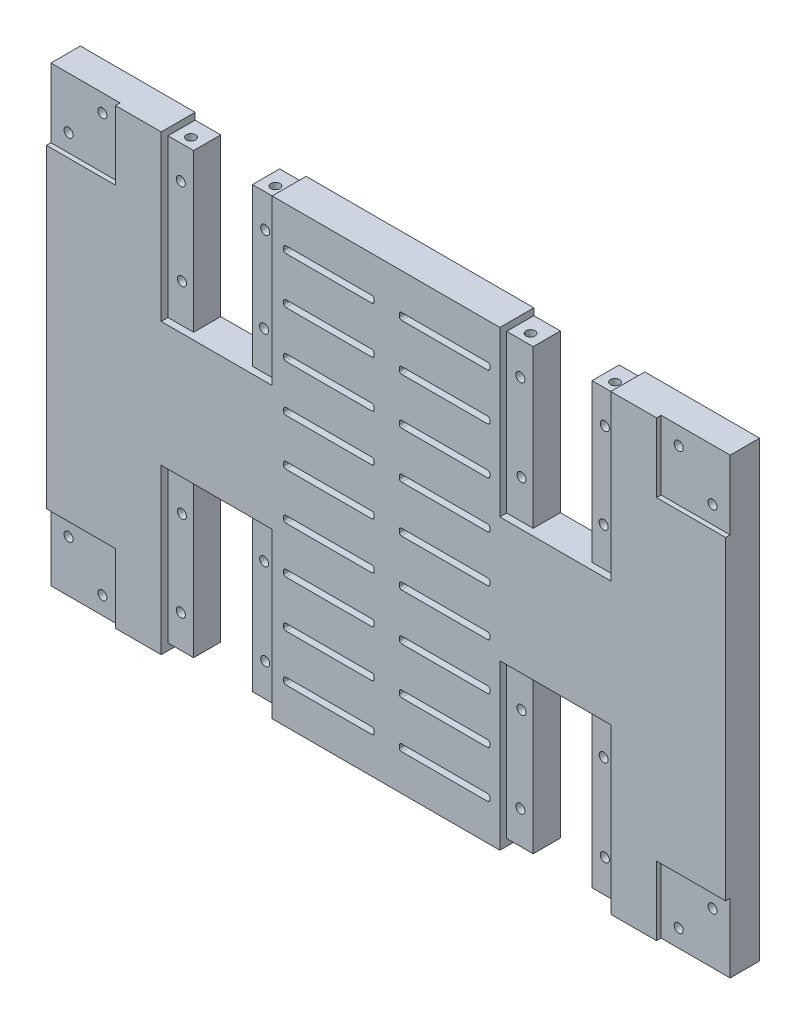
from build123d import *

# Parameters (mm, degrees)
CROQUIS1_W              = 300
CROQUIS1_H              = 200
SALIENTE_EXTRUIR1_DEPTH = 15
CROQUIS2_W              = 30.5
CROQUIS2_H              = 30.5
HUECOS_COLUMNA_DEPTH    = 2
HUECOS_MOTOR_DEPTH      = 181.900525151
CROQUIS4_R              = 2
SIDE_SCREWS_1_DEPTH     = 15
SIDE_START              = -15
CROQUIS5_R              = 2
SIDE_SCREWS_2_DEPTH     = 15
CROQUIS7_R              = 2
SCREWS_AND_VENTI_DEPTH  = 15
CROQUIS9_W              = 49
CROQUIS9_H              = 69.5
CORTAR_EXTRUIR6_DEPTH   = 3


with BuildPart() as part:
    # Croquis1 → Saliente-Extruir1 (new body)
    with BuildSketch(Plane.XY):
        Rectangle(CROQUIS1_W, CROQUIS1_H)
    extrude(amount=SALIENTE_EXTRUIR1_DEPTH)

    # Croquis2 → Huecos columna (cut)
    with BuildSketch(Plane.XY.offset(15)):
        with Locations((-134.75, 84.75)):
            Rectangle(CROQUIS2_W, CROQUIS2_H)
        with Locations((134.75, 84.75)):
            Rectangle(CROQUIS2_W, CROQUIS2_H)
        with Locations((134.75, -84.75)):
            Rectangle(CROQUIS2_W, CROQUIS2_H)
        with Locations((-134.75, -84.75)):
            Rectangle(CROQUIS2_W, CROQUIS2_H)
    extrude(amount=-HUECOS_COLUMNA_DEPTH, mode=Mode.SUBTRACT)

    # Croquis3 → huecos motor (cut, through all)
    with BuildSketch(Plane.XY.offset(15)):
        Polygon((-88, -97), (-88, -27.5), (-62, -27.5), (-62, -97), (-50.295392228, -97), (-50.295392228, -100), (-99.295392228, -100), (-99.295392228, -97), align=None)
        Polygon((88, -27.5), (62, -27.5), (62, -97), (50.295392228, -97), (50.295392228, -100), (99.295392228, -100), (99.295392228, -97), (88, -97), align=None)
        Polygon((88, 97), (88, 27.5), (62, 27.5), (62, 97), (50.295392228, 97), (50.295392228, 100), (99.295392228, 100), (99.295392228, 97), align=None)
        Polygon((-88, 27.5), (-62, 27.5), (-62, 97), (-50.295392228, 97), (-50.295392228, 100), (-99.295392228, 100), (-99.295392228, 97), (-88, 97), align=None)
    extrude(amount=-HUECOS_MOTOR_DEPTH, mode=Mode.SUBTRACT)

    # Croquis4 → side_screws 1 (cut)
    with BuildSketch(Plane.XZ.offset(97)):
        with Locations(Location((-93.647696114, 7.5, 0), (0, 0, 270))):
            Circle(CROQUIS4_R)
        with Locations(Location((-56.352303886, 7.5, 0), (0, 0, 90))):
            Circle(CROQUIS4_R)
        with Locations(Location((56.352303886, 7.5, 0), (0, 0, 270))):
            Circle(CROQUIS4_R)
        with Locations(Location((93.647696114, 7.5, 0), (0, 0, 90))):
            Circle(CROQUIS4_R)
    extrude(amount=-SIDE_SCREWS_1_DEPTH, mode=Mode.SUBTRACT)

    # Croquis5 → side screws 2 (cut)
    with BuildSketch(Plane(origin=(0, 97, 0), x_dir=(1, 0, 0), z_dir=(0, 1, 0)).offset(SIDE_START)):
        with Locations(Location((-93.647696114, -7.5, 0), (0, 0, 90))):
            Circle(CROQUIS5_R)
        with Locations(Location((-56.352303886, -7.5, 0), (0, 0, 270))):
            Circle(CROQUIS5_R)
        with Locations(Location((56.352303886, -7.5, 0), (0, 0, 90))):
            Circle(CROQUIS5_R)
        with Locations(Location((93.647696114, -7.5, 0), (0, 0, 270))):
            Circle(CROQUIS5_R)
    extrude(amount=SIDE_SCREWS_2_DEPTH, mode=Mode.SUBTRACT)

    # Croquis7 → screws and venti (cut)
    with BuildSketch(Plane.XY.offset(15)):
        with Locations((-127.278174593, -92.221825407)):
            Circle(CROQUIS7_R)
        with Locations(Location((-142.221825407, -77.278174593, 0), (0, 0, 180))):
            Circle(CROQUIS7_R)
        with Locations((-127.278174593, 92.221825407)):
            Circle(CROQUIS7_R)
        with Locations((-142.221825407, 77.278174593)):
            Circle(CROQUIS7_R)
        with Locations(Location((127.278174593, -92.221825407, 0), (0, 0, 180))):
            Circle(CROQUIS7_R)
        with Locations((142.221825407, -77.278174593)):
            Circle(CROQUIS7_R)
        with Locations((127.278174593, 92.221825407)):
            Circle(CROQUIS7_R)
        with Locations(Location((142.221825407, 77.278174593, 0), (0, 0, 180))):
            Circle(CROQUIS7_R)
        with Locations((-93.647696114, -82.5)):
            Circle(CROQUIS7_R)
        with Locations((-93.147733982, -44.503289118)):
            Circle(CROQUIS7_R)
        with Locations(Location((-56.352303886, -82.5, 0), (0, 0, 180))):
            Circle(CROQUIS7_R)
        with Locations(Location((-56.852266018, -44.503289118, 0), (0, 0, 180))):
            Circle(CROQUIS7_R)
        with Locations((56.852266018, -44.503289118)):
            Circle(CROQUIS7_R)
        with Locations((56.352303886, -82.5)):
            Circle(CROQUIS7_R)
        with Locations(Location((93.647696114, -82.5, 0), (0, 0, 180))):
            Circle(CROQUIS7_R)
        with Locations(Location((93.147733982, -44.503289118, 0), (0, 0, 180))):
            Circle(CROQUIS7_R)
        with Locations((93.647696114, 82.5)):
            Circle(CROQUIS7_R)
        with Locations((93.147733982, 44.503289118)):
            Circle(CROQUIS7_R)
        with Locations(Location((56.352303886, 82.5, 0), (0, 0, 180))):
            Circle(CROQUIS7_R)
        with Locations(Location((56.852266018, 44.503289118, 0), (0, 0, 180))):
            Circle(CROQUIS7_R)
        with Locations((-56.352303886, 82.5)):
            Circle(CROQUIS7_R)
        with Locations((-56.852266018, 44.503289118)):
            Circle(CROQUIS7_R)
        with Locations(Location((-93.647696114, 82.5, 0), (0, 0, 180))):
            Circle(CROQUIS7_R)
        with Locations(Location((-93.147733982, 44.503289118, 0), (0, 0, 180))):
            Circle(CROQUIS7_R)
        with BuildLine():
            Line((6.875948392, 84), (44.875948392, 84))
            ThreePointArc((44.875948392, 84), (45.583055173, 83.707106781), (45.875948392, 83))
            Line((45.875948392, 83), (45.875948392, 82))
            ThreePointArc((45.875948392, 82), (45.583055173, 81.292893219), (44.875948392, 81))
            Line((44.875948392, 81), (6.875948392, 81))
            ThreePointArc((6.875948392, 81), (6.168841611, 81.292893219), (5.875948392, 82))
            Line((5.875948392, 82), (5.875948392, 83))
            ThreePointArc((5.875948392, 83), (6.168841611, 83.707106781), (6.875948392, 84))
        make_face()
        with BuildLine():
            Line((-44.236036181, 81), (-6.236036181, 81))
            ThreePointArc((-6.236036181, 81), (-5.5289294, 81.292893219), (-5.236036181, 82))
            Line((-5.236036181, 82), (-5.236036181, 83))
            ThreePointArc((-5.236036181, 83), (-5.5289294, 83.707106781), (-6.236036181, 84))
            Line((-6.236036181, 84), (-44.236036181, 84))
            ThreePointArc((-44.236036181, 84), (-44.943142962, 83.707106781), (-45.236036181, 83))
            Line((-45.236036181, 83), (-45.236036181, 82))
            ThreePointArc((-45.236036181, 82), (-44.943142962, 81.292893219), (-44.236036181, 81))
        make_face()
        with BuildLine():
            Line((6.875948392, 63.375), (44.875948392, 63.375))
            ThreePointArc((44.875948392, 63.375), (45.583055173, 63.082106781), (45.875948392, 62.375))
            Line((45.875948392, 62.375), (45.875948392, 61.375))
            ThreePointArc((45.875948392, 61.375), (45.583055173, 60.667893219), (44.875948392, 60.375))
            Line((44.875948392, 60.375), (6.875948392, 60.375))
            ThreePointArc((6.875948392, 60.375), (6.168841611, 60.667893219), (5.875948392, 61.375))
            Line((5.875948392, 61.375), (5.875948392, 62.375))
            ThreePointArc((5.875948392, 62.375), (6.168841611, 63.082106781), (6.875948392, 63.375))
        make_face()
        with BuildLine():
            Line((6.875948392, 42.75), (44.875948392, 42.75))
            ThreePointArc((44.875948392, 42.75), (45.583055173, 42.457106781), (45.875948392, 41.75))
            Line((45.875948392, 41.75), (45.875948392, 40.75))
            ThreePointArc((45.875948392, 40.75), (45.583055173, 40.042893219), (44.875948392, 39.75))
            Line((44.875948392, 39.75), (6.875948392, 39.75))
            ThreePointArc((6.875948392, 39.75), (6.168841611, 40.042893219), (5.875948392, 40.75))
            Line((5.875948392, 40.75), (5.875948392, 41.75))
            ThreePointArc((5.875948392, 41.75), (6.168841611, 42.457106781), (6.875948392, 42.75))
        make_face()
        with BuildLine():
            Line((6.875948392, 22.125), (44.875948392, 22.125))
            ThreePointArc((44.875948392, 22.125), (45.583055173, 21.832106781), (45.875948392, 21.125))
            Line((45.875948392, 21.125), (45.875948392, 20.125))
            ThreePointArc((45.875948392, 20.125), (45.583055173, 19.417893219), (44.875948392, 19.125))
            Line((44.875948392, 19.125), (6.875948392, 19.125))
            ThreePointArc((6.875948392, 19.125), (6.168841611, 19.417893219), (5.875948392, 20.125))
            Line((5.875948392, 20.125), (5.875948392, 21.125))
            ThreePointArc((5.875948392, 21.125), (6.168841611, 21.832106781), (6.875948392, 22.125))
        make_face()
        with BuildLine():
            Line((6.875948392, 1.5), (44.875948392, 1.5))
            ThreePointArc((44.875948392, 1.5), (45.583055173, 1.207106781), (45.875948392, 0.5))
            Line((45.875948392, 0.5), (45.875948392, -0.5))
            ThreePointArc((45.875948392, -0.5), (45.583055173, -1.207106781), (44.875948392, -1.5))
            Line((44.875948392, -1.5), (6.875948392, -1.5))
            ThreePointArc((6.875948392, -1.5), (6.168841611, -1.207106781), (5.875948392, -0.5))
            Line((5.875948392, -0.5), (5.875948392, 0.5))
            ThreePointArc((5.875948392, 0.5), (6.168841611, 1.207106781), (6.875948392, 1.5))
        make_face()
        with BuildLine():
            Line((6.875948392, -19.125), (44.875948392, -19.125))
            ThreePointArc((44.875948392, -19.125), (45.583055173, -19.417893219), (45.875948392, -20.125))
            Line((45.875948392, -20.125), (45.875948392, -21.125))
            ThreePointArc((45.875948392, -21.125), (45.583055173, -21.832106781), (44.875948392, -22.125))
            Line((44.875948392, -22.125), (6.875948392, -22.125))
            ThreePointArc((6.875948392, -22.125), (6.168841611, -21.832106781), (5.875948392, -21.125))
            Line((5.875948392, -21.125), (5.875948392, -20.125))
            ThreePointArc((5.875948392, -20.125), (6.168841611, -19.417893219), (6.875948392, -19.125))
        make_face()
        with BuildLine():
            Line((6.875948392, -39.75), (44.875948392, -39.75))
            ThreePointArc((44.875948392, -39.75), (45.583055173, -40.042893219), (45.875948392, -40.75))
            Line((45.875948392, -40.75), (45.875948392, -41.75))
            ThreePointArc((45.875948392, -41.75), (45.583055173, -42.457106781), (44.875948392, -42.75))
            Line((44.875948392, -42.75), (6.875948392, -42.75))
            ThreePointArc((6.875948392, -42.75), (6.168841611, -42.457106781), (5.875948392, -41.75))
            Line((5.875948392, -41.75), (5.875948392, -40.75))
            ThreePointArc((5.875948392, -40.75), (6.168841611, -40.042893219), (6.875948392, -39.75))
        make_face()
        with BuildLine():
            Line((6.875948392, -60.375), (44.875948392, -60.375))
            ThreePointArc((44.875948392, -60.375), (45.583055173, -60.667893219), (45.875948392, -61.375))
            Line((45.875948392, -61.375), (45.875948392, -62.375))
            ThreePointArc((45.875948392, -62.375), (45.583055173, -63.082106781), (44.875948392, -63.375))
            Line((44.875948392, -63.375), (6.875948392, -63.375))
            ThreePointArc((6.875948392, -63.375), (6.168841611, -63.082106781), (5.875948392, -62.375))
            Line((5.875948392, -62.375), (5.875948392, -61.375))
            ThreePointArc((5.875948392, -61.375), (6.168841611, -60.667893219), (6.875948392, -60.375))
        make_face()
        with BuildLine():
            Line((6.875948392, -81), (44.875948392, -81))
            ThreePointArc((44.875948392, -81), (45.583055173, -81.292893219), (45.875948392, -82))
            Line((45.875948392, -82), (45.875948392, -83))
            ThreePointArc((45.875948392, -83), (45.583055173, -83.707106781), (44.875948392, -84))
            Line((44.875948392, -84), (6.875948392, -84))
            ThreePointArc((6.875948392, -84), (6.168841611, -83.707106781), (5.875948392, -83))
            Line((5.875948392, -83), (5.875948392, -82))
            ThreePointArc((5.875948392, -82), (6.168841611, -81.292893219), (6.875948392, -81))
        make_face()
        with BuildLine():
            Line((-44.236036181, 63.375), (-6.236036181, 63.375))
            ThreePointArc((-6.236036181, 63.375), (-5.5289294, 63.082106781), (-5.236036181, 62.375))
            Line((-5.236036181, 62.375), (-5.236036181, 61.375))
            ThreePointArc((-5.236036181, 61.375), (-5.5289294, 60.667893219), (-6.236036181, 60.375))
            Line((-6.236036181, 60.375), (-44.236036181, 60.375))
            ThreePointArc((-44.236036181, 60.375), (-44.943142962, 60.667893219), (-45.236036181, 61.375))
            Line((-45.236036181, 61.375), (-45.236036181, 62.375))
            ThreePointArc((-45.236036181, 62.375), (-44.943142962, 63.082106781), (-44.236036181, 63.375))
        make_face()
        with BuildLine():
            Line((-44.236036181, 42.75), (-6.236036181, 42.75))
            ThreePointArc((-6.236036181, 42.75), (-5.5289294, 42.457106781), (-5.236036181, 41.75))
            Line((-5.236036181, 41.75), (-5.236036181, 40.75))
            ThreePointArc((-5.236036181, 40.75), (-5.5289294, 40.042893219), (-6.236036181, 39.75))
            Line((-6.236036181, 39.75), (-44.236036181, 39.75))
            ThreePointArc((-44.236036181, 39.75), (-44.943142962, 40.042893219), (-45.236036181, 40.75))
            Line((-45.236036181, 40.75), (-45.236036181, 41.75))
            ThreePointArc((-45.236036181, 41.75), (-44.943142962, 42.457106781), (-44.236036181, 42.75))
        make_face()
        with BuildLine():
            Line((-44.236036181, 22.125), (-6.236036181, 22.125))
            ThreePointArc((-6.236036181, 22.125), (-5.5289294, 21.832106781), (-5.236036181, 21.125))
            Line((-5.236036181, 21.125), (-5.236036181, 20.125))
            ThreePointArc((-5.236036181, 20.125), (-5.5289294, 19.417893219), (-6.236036181, 19.125))
            Line((-6.236036181, 19.125), (-44.236036181, 19.125))
            ThreePointArc((-44.236036181, 19.125), (-44.943142962, 19.417893219), (-45.236036181, 20.125))
            Line((-45.236036181, 20.125), (-45.236036181, 21.125))
            ThreePointArc((-45.236036181, 21.125), (-44.943142962, 21.832106781), (-44.236036181, 22.125))
        make_face()
        with BuildLine():
            Line((-44.236036181, 1.5), (-6.236036181, 1.5))
            ThreePointArc((-6.236036181, 1.5), (-5.5289294, 1.207106781), (-5.236036181, 0.5))
            Line((-5.236036181, 0.5), (-5.236036181, -0.5))
            ThreePointArc((-5.236036181, -0.5), (-5.5289294, -1.207106781), (-6.236036181, -1.5))
            Line((-6.236036181, -1.5), (-44.236036181, -1.5))
            ThreePointArc((-44.236036181, -1.5), (-44.943142962, -1.207106781), (-45.236036181, -0.5))
            Line((-45.236036181, -0.5), (-45.236036181, 0.5))
            ThreePointArc((-45.236036181, 0.5), (-44.943142962, 1.207106781), (-44.236036181, 1.5))
        make_face()
        with BuildLine():
            Line((-44.236036181, -19.125), (-6.236036181, -19.125))
            ThreePointArc((-6.236036181, -19.125), (-5.5289294, -19.417893219), (-5.236036181, -20.125))
            Line((-5.236036181, -20.125), (-5.236036181, -21.125))
            ThreePointArc((-5.236036181, -21.125), (-5.5289294, -21.832106781), (-6.236036181, -22.125))
            Line((-6.236036181, -22.125), (-44.236036181, -22.125))
            ThreePointArc((-44.236036181, -22.125), (-44.943142962, -21.832106781), (-45.236036181, -21.125))
            Line((-45.236036181, -21.125), (-45.236036181, -20.125))
            ThreePointArc((-45.236036181, -20.125), (-44.943142962, -19.417893219), (-44.236036181, -19.125))
        make_face()
        with BuildLine():
            Line((-44.236036181, -39.75), (-6.236036181, -39.75))
            ThreePointArc((-6.236036181, -39.75), (-5.5289294, -40.042893219), (-5.236036181, -40.75))
            Line((-5.236036181, -40.75), (-5.236036181, -41.75))
            ThreePointArc((-5.236036181, -41.75), (-5.5289294, -42.457106781), (-6.236036181, -42.75))
            Line((-6.236036181, -42.75), (-44.236036181, -42.75))
            ThreePointArc((-44.236036181, -42.75), (-44.943142962, -42.457106781), (-45.236036181, -41.75))
            Line((-45.236036181, -41.75), (-45.236036181, -40.75))
            ThreePointArc((-45.236036181, -40.75), (-44.943142962, -40.042893219), (-44.236036181, -39.75))
        make_face()
        with BuildLine():
            Line((-44.236036181, -60.375), (-6.236036181, -60.375))
            ThreePointArc((-6.236036181, -60.375), (-5.5289294, -60.667893219), (-5.236036181, -61.375))
            Line((-5.236036181, -61.375), (-5.236036181, -62.375))
            ThreePointArc((-5.236036181, -62.375), (-5.5289294, -63.082106781), (-6.236036181, -63.375))
            Line((-6.236036181, -63.375), (-44.236036181, -63.375))
            ThreePointArc((-44.236036181, -63.375), (-44.943142962, -63.082106781), (-45.236036181, -62.375))
            Line((-45.236036181, -62.375), (-45.236036181, -61.375))
            ThreePointArc((-45.236036181, -61.375), (-44.943142962, -60.667893219), (-44.236036181, -60.375))
        make_face()
        with BuildLine():
            Line((-44.236036181, -81), (-6.236036181, -81))
            ThreePointArc((-6.236036181, -81), (-5.5289294, -81.292893219), (-5.236036181, -82))
            Line((-5.236036181, -82), (-5.236036181, -83))
            ThreePointArc((-5.236036181, -83), (-5.5289294, -83.707106781), (-6.236036181, -84))
            Line((-6.236036181, -84), (-44.236036181, -84))
            ThreePointArc((-44.236036181, -84), (-44.943142962, -83.707106781), (-45.236036181, -83))
            Line((-45.236036181, -83), (-45.236036181, -82))
            ThreePointArc((-45.236036181, -82), (-44.943142962, -81.292893219), (-44.236036181, -81))
        make_face()
    extrude(amount=-SCREWS_AND_VENTI_DEPTH, mode=Mode.SUBTRACT)

    # Croquis9 → Cortar-Extruir6 (cut)
    with BuildSketch(Plane.XY.offset(15)):
        with Locations((-74.795392228, -62.25)):
            Rectangle(CROQUIS9_W, CROQUIS9_H)
        with Locations((74.795392228, -62.25)):
            Rectangle(CROQUIS9_W, CROQUIS9_H)
        with Locations((74.795392228, 62.25)):
            Rectangle(CROQUIS9_W, CROQUIS9_H)
        with Locations((-74.795392228, 62.25)):
            Rectangle(CROQUIS9_W, CROQUIS9_H)
    extrude(amount=-CORTAR_EXTRUIR6_DEPTH, mode=Mode.SUBTRACT)


solid = part.part
